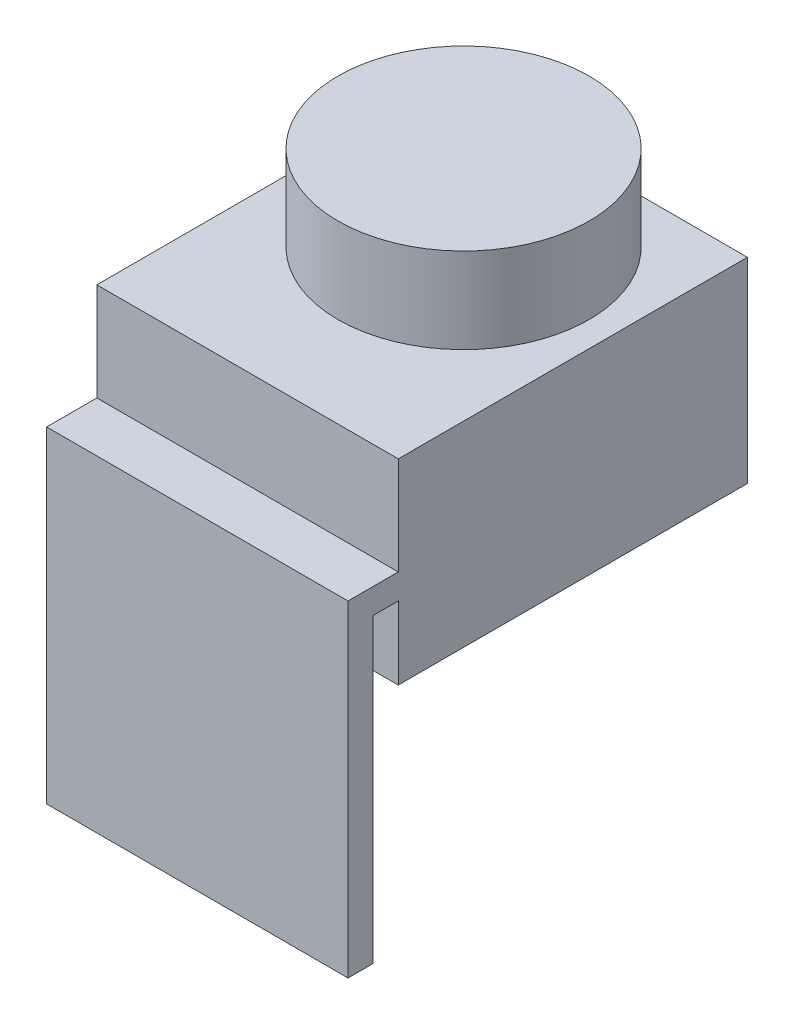
from build123d import *

# Parameters (mm, degrees)
SKETCH1_W           = 6
SKETCH1_H           = 6.95
BOSS_EXTRUDE1_DEPTH = 1.95
SKETCH2_R           = 2.5
BOSS_EXTRUDE2_DEPTH = 1.7
SKETCH3_W           = 6
SKETCH3_H           = 0.5
BOSS_EXTRUDE3_DEPTH = 1
SKETCH4_W           = 6
SKETCH4_H           = 0.5
BOSS_EXTRUDE4_DEPTH = 6


with BuildPart() as part:
    # Sketch1 → Boss-Extrude1 (new, symmetric)
    with BuildSketch(Plane(origin=(0, 0, 0), x_dir=(1, 0, 0), z_dir=(0, 1, 0))):
        with Locations((0, -0.825)):
            Rectangle(SKETCH1_W, SKETCH1_H)
    extrude(amount=BOSS_EXTRUDE1_DEPTH, both=True)

    # Sketch2 → Boss-Extrude2 (add)
    with BuildSketch(Plane(origin=(0, 1.95, 0), x_dir=(1, 0, 0), z_dir=(0, 1, 0))):
        with Locations(Location((0, 0, 0), (0, 0, 270))):
            Circle(SKETCH2_R)
    extrude(amount=BOSS_EXTRUDE2_DEPTH)

    # Sketch3 → Boss-Extrude3 (add)
    with BuildSketch(Plane.XY.offset(4.3)):
        with Locations((0, -0.25)):
            Rectangle(SKETCH3_W, SKETCH3_H)
    extrude(amount=BOSS_EXTRUDE3_DEPTH)

    # Sketch4 → Boss-Extrude4 (add)
    with BuildSketch(Plane.XZ.offset(0.5)):
        with Locations((0, 5.05)):
            Rectangle(SKETCH4_W, SKETCH4_H)
    extrude(amount=BOSS_EXTRUDE4_DEPTH)


solid = part.part
